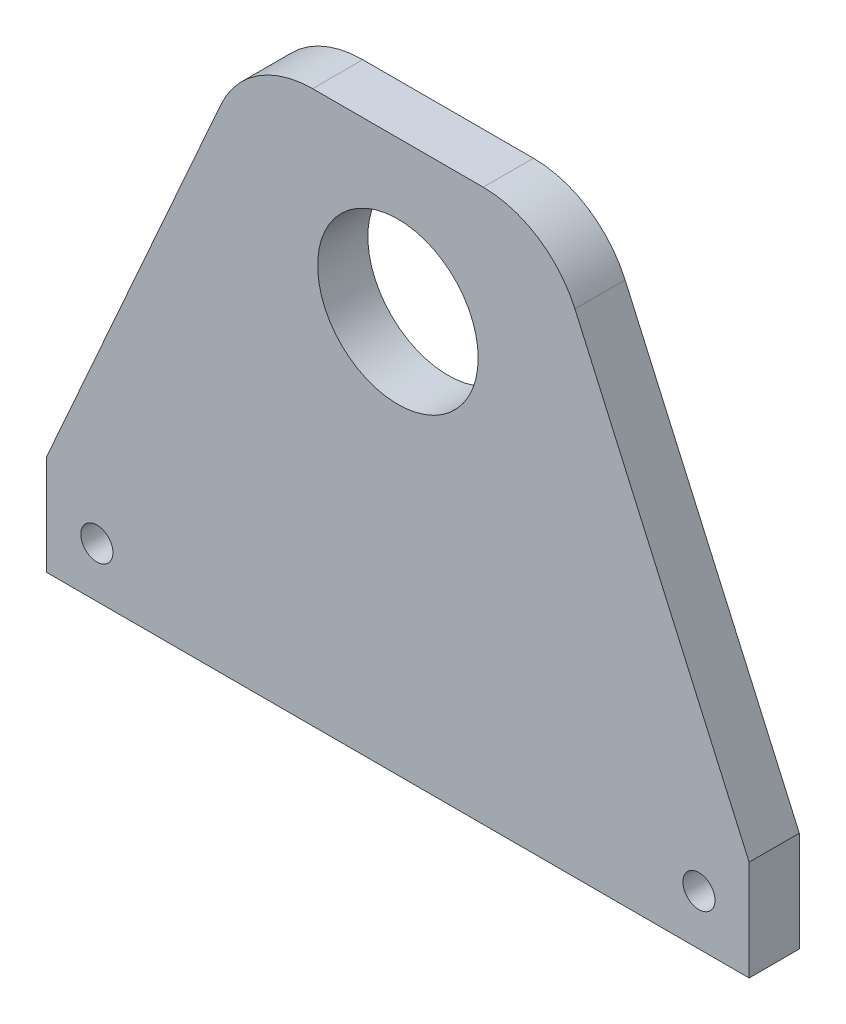
from build123d import *

# Parameters (mm, degrees)
SKETCH_1_R      = 8
SKETCH_1_R_2    = 1.6
EXTRUDE_1_DEPTH = 5
FILLET_1_R      = 10


with BuildPart() as part:
    # ｽｹｯﾁ1 → ﾎﾞｽ - 押し出し1 (new body)
    with BuildSketch(Plane.XY):
        Polygon((0, 0), (0, 10), (20, 55), (50, 55), (70, 10), (70, 0), align=None)
        with Locations((35, 40)):
            Circle(SKETCH_1_R, mode=Mode.SUBTRACT)
        with Locations((5, 5)):
            Circle(SKETCH_1_R_2, mode=Mode.SUBTRACT)
        with Locations((65, 5)):
            Circle(SKETCH_1_R_2, mode=Mode.SUBTRACT)
    extrude(amount=EXTRUDE_1_DEPTH)

    # ﾌｨﾚｯﾄ1
    fillet_1_edges = [part.edges().sort_by_distance(p)[0] for p in [
        (20, 55, 2.5),
        (50, 55, 2.5),
    ]]
    fillet(fillet_1_edges, radius=FILLET_1_R)


solid = part.part
